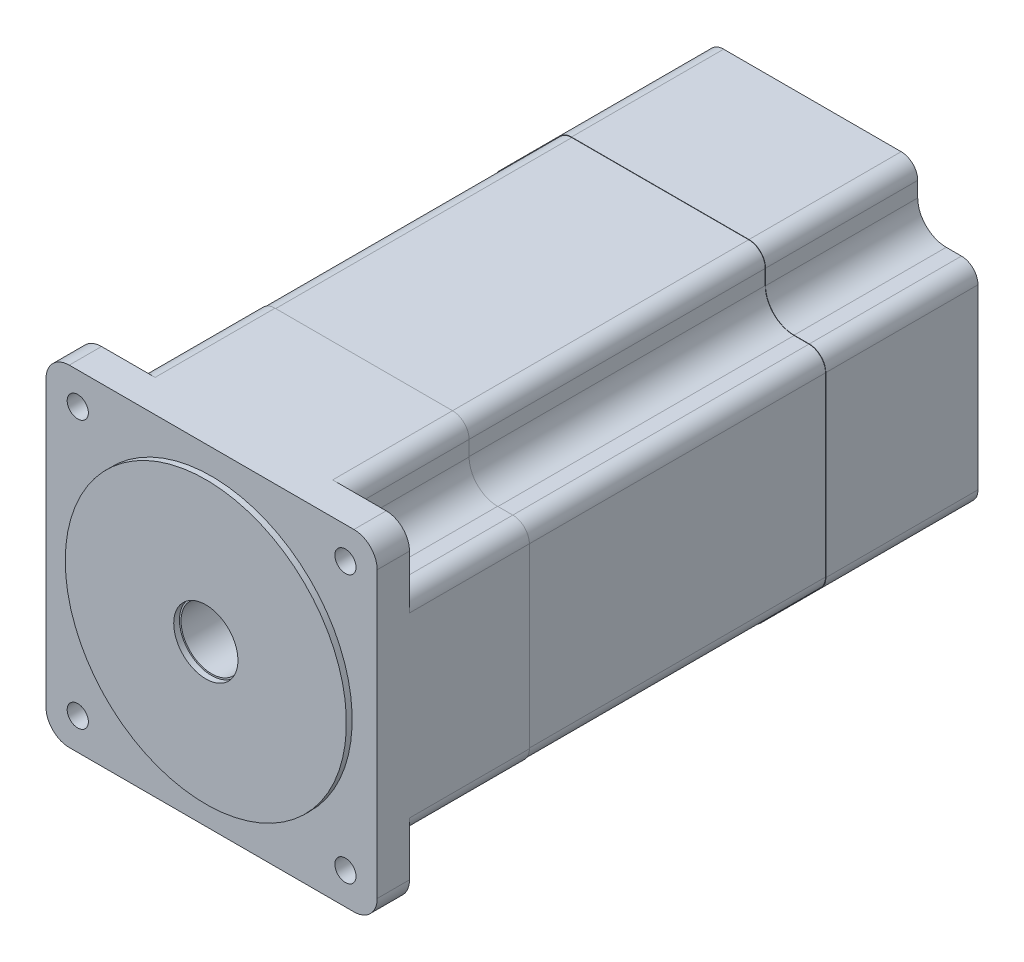
from build123d import *

# Parameters (mm, degrees)
SKETCH9_OUTSIDE_W          = 164.226
SKETCH9_OUTSIDE_H          = 164.226
BODY_CUT_DEPTH             = 177.452945975
SKETCH10_OUTSIDE_W         = 127.798
SKETCH10_OUTSIDE_H         = 127.798
BODY_CUT_INNER_DEPTH       = 76.981920155
CUT_FIXING_HOLE_START      = -39.50904
SKETCH15_R                 = 2.75
CUT_FIXING_HOLE_DEPTH      = 39.50904
SKETCH16_R                 = 1.25
CUT_BACK_FIXING_HOLE_DEPTH = 133.739845789
CUT_CORNER_DEPTH           = 160.654828928
CUT_CORNER_INNER_START     = -76.98192
CUT_CORNER_INNER_DEPTH     = 76.98192
SKETCH18_W                 = 2
SKETCH18_H                 = 50.098076211
COSMETIC_FILLET_INNER_R    = 4.3
COSMETIC_FILLET_R          = 4.3


with BuildPart() as part:
    # Sketch5 → Body-Front (revolve)
    with BuildSketch(Plane(origin=(0, 0, 0), x_dir=(0, 0, -1), z_dir=(1, 0, 0)), mode=Mode.PRIVATE) as body_front_sk:
        Polygon((0, 8.339423789), (0, 7.9375), (38.490960077, 7.9375), (38.490960077, 29.153992315), (39.509039923, 29.153992315), (39.509039923, 58.307984631), (0, 58.307984631), (0, 36.5), (-1.5, 36.5), (-1.5, 8.339423789), align=None)
    revolve(body_front_sk.sketch.rotate(Axis((0, 0, -80.9), (0, 0, 1)), 90), axis=Axis((0, 0, -80.9), (0, 0, 1)))

    # Sketch6 → Body-Middle (revolve)
    with BuildSketch(Plane(origin=(0, 0, 0), x_dir=(0, 0, -1), z_dir=(1, 0, 0)), mode=Mode.PRIVATE) as body_middle_sk:
        Polygon((39.509039923, 29.153992315), (39.509039923, 58.307984631), (116.490960077, 58.307984631), (116.490960077, 29.153992315), (117.509039923, 29.153992315), (117.509039923, 7.9375), (38.490960077, 7.9375), (38.490960077, 29.153992315), align=None)
    revolve(body_middle_sk.sketch.rotate(Axis((0, 0, -80.9), (0, 0, 1)), 90), axis=Axis((0, 0, -80.9), (0, 0, 1)))

    # Sketch7 → Body-Back (revolve)
    with BuildSketch(Plane(origin=(0, 0, 0), x_dir=(0, 0, -1), z_dir=(1, 0, 0)), mode=Mode.PRIVATE) as body_back_sk:
        Polygon((156, 58.307984631), (116.490960077, 58.307984631), (116.490960077, 29.153992315), (117.509039923, 29.153992315), (117.509039923, 2.5), (154.5, 2.5), (154.5, 2.901923789), (156, 2.901923789), align=None)
    revolve(body_back_sk.sketch.rotate(Axis((0, 0, -80.9), (0, 0, 1)), 90), axis=Axis((0, 0, -80.9), (0, 0, 1)))

    # Sketch9 outside → Body-Cut (cut, through all)
    with BuildSketch(Plane.XY):
        Rectangle(SKETCH9_OUTSIDE_W, SKETCH9_OUTSIDE_H)
        with BuildLine():
            Line((-36.956744108, 43), (36.956744108, 43))
            ThreePointArc((36.956744108, 43), (41.22997133, 41.22997133), (43, 36.956744108))
            Line((43, 36.956744108), (43, -36.956744108))
            ThreePointArc((43, -36.956744108), (41.22997133, -41.22997133), (36.956744108, -43))
            Line((36.956744108, -43), (-36.956744108, -43))
            ThreePointArc((-36.956744108, -43), (-41.22997133, -41.22997133), (-43, -36.956744108))
            Line((-43, -36.956744108), (-43, 36.956744108))
            ThreePointArc((-43, 36.956744108), (-41.22997133, 41.22997133), (-36.956744108, 43))
        make_face(mode=Mode.SUBTRACT)
    extrude(amount=-BODY_CUT_DEPTH, mode=Mode.SUBTRACT)

    # Sketch10 outside → Body-Cut-Inner (cut)
    with BuildSketch(Plane.XY.offset(-39.509039923)):
        Rectangle(SKETCH10_OUTSIDE_W, SKETCH10_OUTSIDE_H)
        with BuildLine():
            Line((-42.914, 36.956744108), (-42.914, -36.956744108))
            ThreePointArc((-42.914, -36.956744108), (-41.169160146, -41.169160146), (-36.956744108, -42.914))
            Line((-36.956744108, -42.914), (36.956744108, -42.914))
            ThreePointArc((36.956744108, -42.914), (41.169160146, -41.169160146), (42.914, -36.956744108))
            Line((42.914, -36.956744108), (42.914, 36.956744108))
            ThreePointArc((42.914, 36.956744108), (41.169160146, 41.169160146), (36.956744108, 42.914))
            Line((36.956744108, 42.914), (-36.956744108, 42.914))
            ThreePointArc((-36.956744108, 42.914), (-41.169160146, 41.169160146), (-42.914, 36.956744108))
        make_face(mode=Mode.SUBTRACT)
    extrude(amount=-BODY_CUT_INNER_DEPTH, mode=Mode.SUBTRACT)

    # Sketch15 → Cut-Fixing-Hole (cut)
    with BuildSketch(Plane.XY.offset(CUT_FIXING_HOLE_START)):
        with Locations((34.75, -34.75)):
            Circle(SKETCH15_R)
        with Locations((-34.75, -34.75)):
            Circle(SKETCH15_R)
        with Locations((34.75, 34.75)):
            Circle(SKETCH15_R)
        with Locations((-34.75, 34.75)):
            Circle(SKETCH15_R)
    extrude(amount=CUT_FIXING_HOLE_DEPTH, mode=Mode.SUBTRACT)

    # Sketch16 → Cut-Back-Fixing-Hole (cut, through all)
    with BuildSketch(Plane.XY.offset(-116.490960077)):
        with Locations((-23, 0)):
            Circle(SKETCH16_R)
        with Locations((23, 0)):
            Circle(SKETCH16_R)
    extrude(amount=-CUT_BACK_FIXING_HOLE_DEPTH, mode=Mode.SUBTRACT)

    # Sketch11 → Cut-Corner (cut, through all)
    with BuildSketch(Plane.XY.offset(-8.38)):
        with BuildLine():
            Line((-27.349279927, 43), (-27.349279927, 34.75))
            ThreePointArc((-27.349279927, 34.75), (-29.51690065, 29.51690065), (-34.75, 27.349279927))
            Line((-34.75, 27.349279927), (-43, 27.349279927))
            Line((-43, 27.349279927), (-43, 36.956744108))
            ThreePointArc((-43, 36.956744108), (-41.22997133, 41.22997133), (-36.956744108, 43))
            Line((-36.956744108, 43), (-27.349279927, 43))
        make_face()
        with BuildLine():
            Line((-34.75, -27.349279927), (-43, -27.349279927))
            Line((-43, -27.349279927), (-43, -36.956744108))
            ThreePointArc((-43, -36.956744108), (-41.22997133, -41.22997133), (-36.956744108, -43))
            Line((-36.956744108, -43), (-27.349279927, -43))
            Line((-27.349279927, -43), (-27.349279927, -34.75))
            ThreePointArc((-27.349279927, -34.75), (-29.51690065, -29.51690065), (-34.75, -27.349279927))
        make_face()
        with BuildLine():
            Line((27.349279927, -43), (27.349279927, -34.75))
            ThreePointArc((27.349279927, -34.75), (29.51690065, -29.51690065), (34.75, -27.349279927))
            Line((34.75, -27.349279927), (43, -27.349279927))
            Line((43, -27.349279927), (43, -36.956744108))
            ThreePointArc((43, -36.956744108), (41.22997133, -41.22997133), (36.956744108, -43))
            Line((36.956744108, -43), (27.349279927, -43))
        make_face()
        with BuildLine():
            Line((43, 36.956744108), (43, 27.349279927))
            Line((43, 27.349279927), (34.75, 27.349279927))
            ThreePointArc((34.75, 27.349279927), (29.51690065, 29.51690065), (27.349279927, 34.75))
            Line((27.349279927, 34.75), (27.349279927, 43))
            Line((27.349279927, 43), (36.956744108, 43))
            ThreePointArc((36.956744108, 43), (41.22997133, 41.22997133), (43, 36.956744108))
        make_face()
    extrude(amount=-CUT_CORNER_DEPTH, mode=Mode.SUBTRACT)

    # Sketch13 → Cut-Corner-Inner (cut)
    with BuildSketch(Plane.XY.offset(-39.509039923).offset(CUT_CORNER_INNER_START)):
        with BuildLine():
            Line((-34.75, 27.263279927), (-43, 27.263279927))
            Line((-43, 27.263279927), (-43, 36.956744108))
            ThreePointArc((-43, 36.956744108), (-41.22997133, 41.22997133), (-36.956744108, 43))
            Line((-36.956744108, 43), (-27.263279927, 43))
            Line((-27.263279927, 43), (-27.263279927, 34.75))
            ThreePointArc((-27.263279927, 34.75), (-29.456089467, 29.456089467), (-34.75, 27.263279927))
        make_face()
        with BuildLine():
            Line((-34.75, -27.263279927), (-43, -27.263279927))
            Line((-43, -27.263279927), (-43, -36.956744108))
            ThreePointArc((-43, -36.956744108), (-41.22997133, -41.22997133), (-36.956744108, -43))
            Line((-36.956744108, -43), (-27.263279927, -43))
            Line((-27.263279927, -43), (-27.263279927, -34.75))
            ThreePointArc((-27.263279927, -34.75), (-29.456089467, -29.456089467), (-34.75, -27.263279927))
        make_face()
        with BuildLine():
            Line((27.263279927, -43), (27.263279927, -34.75))
            ThreePointArc((27.263279927, -34.75), (29.456089467, -29.456089467), (34.75, -27.263279927))
            Line((34.75, -27.263279927), (43, -27.263279927))
            Line((43, -27.263279927), (43, -36.956744108))
            ThreePointArc((43, -36.956744108), (41.22997133, -41.22997133), (36.956744108, -43))
            Line((36.956744108, -43), (27.263279927, -43))
        make_face()
        with BuildLine():
            Line((43, 36.956744108), (43, 27.263279927))
            Line((43, 27.263279927), (34.75, 27.263279927))
            ThreePointArc((34.75, 27.263279927), (29.456089467, 29.456089467), (27.263279927, 34.75))
            Line((27.263279927, 34.75), (27.263279927, 43))
            Line((27.263279927, 43), (36.956744108, 43))
            ThreePointArc((36.956744108, 43), (41.22997133, 41.22997133), (43, 36.956744108))
        make_face()
    extrude(amount=CUT_CORNER_INNER_DEPTH, mode=Mode.SUBTRACT)

    # Sketch18 → Body-Cable (revolve)
    with BuildSketch(Plane(origin=(0, 0, 0), x_dir=(0, 0, -1), z_dir=(1, 0, 0))):
        with Locations((135.754519961, -27.950961895)):
            Rectangle(SKETCH18_W, SKETCH18_H)
    revolve(axis=Axis((0, 29.153992315, -136.754519961), (0, -1, 0)))

    # Cosmetic-Fillet-Inner
    cosmetic_fillet_inner_edges = [part.edges().sort_by_distance(p)[0] for p in [
        (-27.263279927, 42.914, -77.999999923),
        (-42.914, 27.263279927, -77.999999923),
        (-27.263279927, -42.914, -77.999999923),
        (-42.914, -27.263279927, -77.999999923),
        (42.914, -27.263279927, -77.999999923),
        (27.263279927, -42.914, -77.999999923),
        (42.914, 27.263279927, -77.999999923),
        (27.263279927, 42.914, -77.999999923),
    ]]
    fillet(cosmetic_fillet_inner_edges, radius=COSMETIC_FILLET_INNER_R)

    # Cosmetic-Fillet
    cosmetic_fillet_edges = [part.edges().sort_by_distance(p)[0] for p in [
        (-27.349279927, 43, -23.944519961),
        (-27.349279927, 43, -136.245480039),
        (-43, 27.349279927, -23.944519961),
        (-43, 27.349279927, -136.245480039),
        (-27.349279927, -43, -23.944519961),
        (-43, -27.349279927, -23.944519961),
        (-43, -27.349279927, -136.245480039),
        (-27.349279927, -43, -136.245480039),
        (43, -27.349279927, -23.944519961),
        (27.349279927, -43, -23.944519961),
        (27.349279927, -43, -136.245480039),
        (43, -27.349279927, -136.245480039),
        (27.349279927, 43, -23.944519961),
        (43, 27.349279927, -23.944519961),
        (43, 27.349279927, -136.245480039),
        (27.349279927, 43, -136.245480039),
    ]]
    fillet(cosmetic_fillet_edges, radius=COSMETIC_FILLET_R)


solid = part.part
